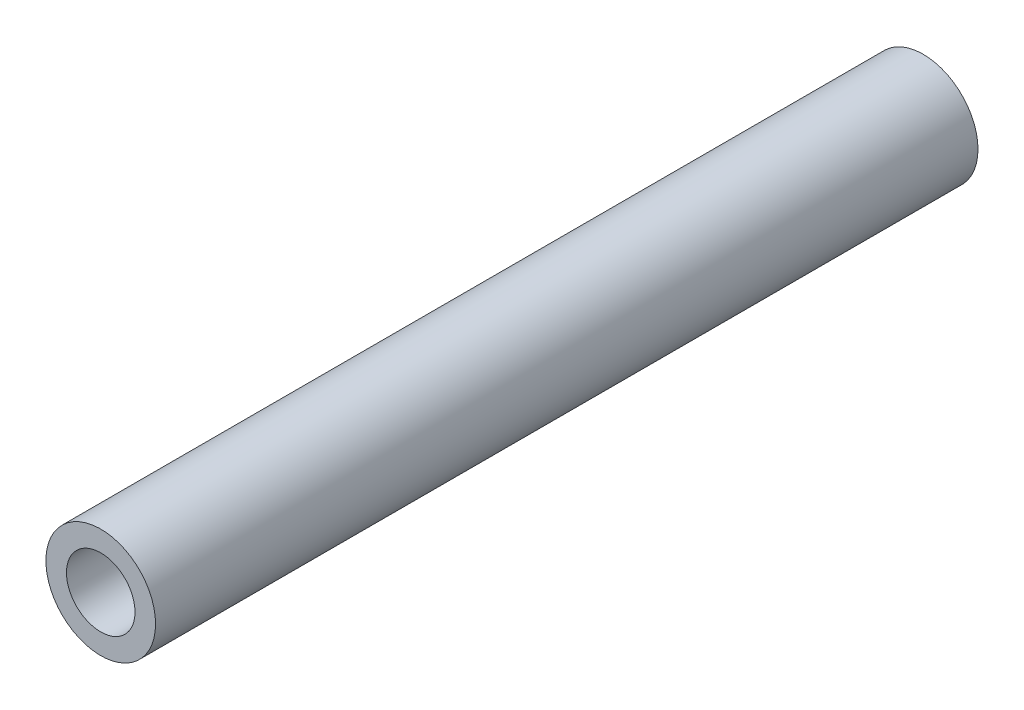
from build123d import *

# Parameters (mm, degrees)
SKETCH1_R           = 4
SKETCH1_R_2         = 2.5
BOSS_EXTRUDE1_DEPTH = 60


with BuildPart() as part:
    # Sketch1 → Boss-Extrude1 (new body)
    with BuildSketch(Plane.XY):
        Circle(SKETCH1_R)
        Circle(SKETCH1_R_2, mode=Mode.SUBTRACT)
    extrude(amount=BOSS_EXTRUDE1_DEPTH)


solid = part.part
